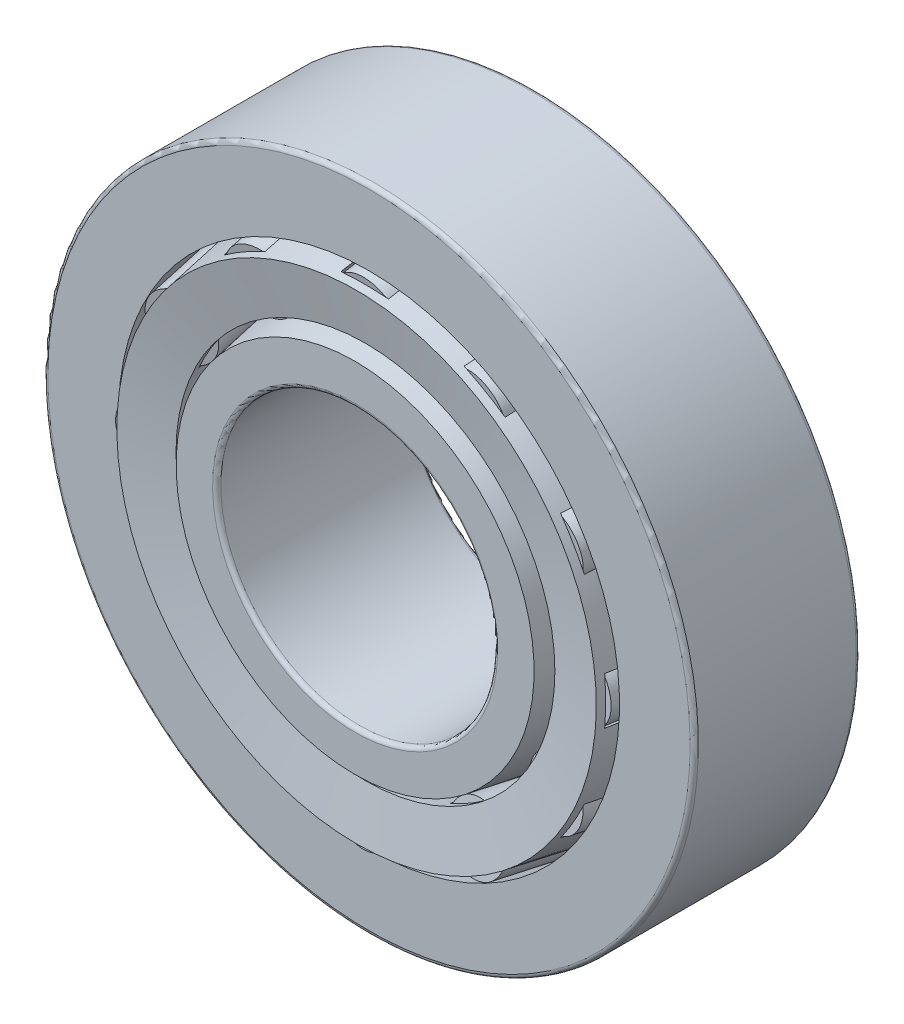
from build123d import *

# Parameters (mm, degrees)
CIRPATTERN1_COUNT = 12
CIRPATTERN2_COUNT = 12
CIRPATTERN2_ANGLE = 330
FILLET1_R         = 0.3
FILLET2_R         = 0.3


with BuildPart() as part:
    # Sketch1 → Revolve1 (revolve)
    with BuildSketch(Plane(origin=(0, 0, 0), x_dir=(0, 0, -1), z_dir=(1, 0, 0)), mode=Mode.PRIVATE) as revolve1_sk:
        Polygon((-6, 23.5), (6, 23.5), (6, 20.215923769), (-6, 18.1), align=None)
    revolve(revolve1_sk.sketch.rotate(Axis((0, 0, 7), (0, 0, -1)), 180), axis=Axis((0, 0, 7), (0, 0, -1)))

    # Fillet1
    fillet1_edges = [part.edges().sort_by_distance(p)[0] for p in [
        (0, 23.5, -6),
        (0, 23.5, 6),
    ]]
    fillet(fillet1_edges, radius=FILLET1_R)


with BuildPart() as body_2:
    # Sketch5 → Revolve4 (revolve)
    with BuildSketch(Plane(origin=(0, 0, 0), x_dir=(0, 0, -1), z_dir=(1, 0, 0)), mode=Mode.PRIVATE) as revolve4_sk:
        Polygon((7, 15.4), (-7, 12.93142227), (-7, 10), (7, 10), align=None)
    revolve(revolve4_sk.sketch.rotate(Axis((0, 0, 7), (0, 0, -1)), 180), axis=Axis((0, 0, 7), (0, 0, -1)))

    # Fillet2
    fillet2_edges = [body_2.edges().sort_by_distance(p)[0] for p in [
        (0, 10, 7),
        (0, 10, -7),
    ]]
    fillet(fillet2_edges, radius=FILLET2_R)


with BuildPart() as body_3:
    # Sketch2 → Revolve2 (revolve)
    with BuildSketch(Plane(origin=(0, 0, 0), x_dir=(0, 0, -1), z_dir=(1, 0, 0)), mode=Mode.PRIVATE) as revolve2_sk:
        Polygon((-6.893284355, 17.318458523), (-6.252990486, 13.687171546), (6, 15.847704363), (8.143284355, 16.225623222), (7.502990486, 19.856910199), (6, 19.591892425), align=None)
    revolve(revolve2_sk.sketch.rotate(Axis((0, 0, 7), (0, 0, -1)), 180), axis=Axis((0, 0, 7), (0, 0, -1)))

    # Sketch3 → Cut-Revolve1 (revolve, cut)
    with BuildSketch(Plane(origin=(0, 0, 0), x_dir=(0, 0, -1), z_dir=(1, 0, 0))):
        Polygon((-6, 15.603874625), (-6.426862579, 18.02473261), (5.573137421, 20.140656379), (6, 17.719798394), align=None)
    cut_revolve1 = revolve(axis=Axis((0, 15.502815034, 6.573137421), (0, 0.17364817766692742, -0.9848077530122086)), mode=Mode.SUBTRACT)

    # CirPattern1: Cut-Revolve1 ×12 about axis
    cirpattern1_axis = Axis((0, 0, 0), (0, 0, 1))
    for i in range(1, CIRPATTERN1_COUNT):
        add(cut_revolve1.rotate(cirpattern1_axis, i * 360 / CIRPATTERN1_COUNT), mode=Mode.SUBTRACT)


with BuildPart() as body_4:
    # Sketch4 → Revolve3 (revolve)
    with BuildSketch(Plane(origin=(0, 0, 0), x_dir=(0, 0, -1), z_dir=(1, 0, 0)), mode=Mode.PRIVATE) as revolve3_sk:
        Polygon((-6.404809261, 17.899662026), (5.595190739, 20.015585794), (6, 17.719798394), (-6, 15.603874625), align=None)
    revolve(revolve3_sk.sketch.rotate(Axis((0, 15.502815034, 6.573137421), (0, 0.17364817766692742, -0.9848077530122086)), 180), axis=Axis((0, 15.502815034, 6.573137421), (0, 0.17364817766692742, -0.9848077530122086)))


with BuildPart() as cirpattern2_1:
    # CirPattern2: pattern copy
    add(body_4.part.rotate(Axis((0, 0, -7), (0, 0, 1)), 1 * CIRPATTERN2_ANGLE / (CIRPATTERN2_COUNT - 1)))


with BuildPart() as cirpattern2_2:
    # CirPattern2: pattern copy
    add(body_4.part.rotate(Axis((0, 0, -7), (0, 0, 1)), 2 * CIRPATTERN2_ANGLE / (CIRPATTERN2_COUNT - 1)))


with BuildPart() as cirpattern2_3:
    # CirPattern2: pattern copy
    add(body_4.part.rotate(Axis((0, 0, -7), (0, 0, 1)), 3 * CIRPATTERN2_ANGLE / (CIRPATTERN2_COUNT - 1)))


with BuildPart() as cirpattern2_4:
    # CirPattern2: pattern copy
    add(body_4.part.rotate(Axis((0, 0, -7), (0, 0, 1)), 4 * CIRPATTERN2_ANGLE / (CIRPATTERN2_COUNT - 1)))


with BuildPart() as cirpattern2_5:
    # CirPattern2: pattern copy
    add(body_4.part.rotate(Axis((0, 0, -7), (0, 0, 1)), 5 * CIRPATTERN2_ANGLE / (CIRPATTERN2_COUNT - 1)))


with BuildPart() as cirpattern2_6:
    # CirPattern2: pattern copy
    add(body_4.part.rotate(Axis((0, 0, -7), (0, 0, 1)), 6 * CIRPATTERN2_ANGLE / (CIRPATTERN2_COUNT - 1)))


with BuildPart() as cirpattern2_7:
    # CirPattern2: pattern copy
    add(body_4.part.rotate(Axis((0, 0, -7), (0, 0, 1)), 7 * CIRPATTERN2_ANGLE / (CIRPATTERN2_COUNT - 1)))


with BuildPart() as cirpattern2_8:
    # CirPattern2: pattern copy
    add(body_4.part.rotate(Axis((0, 0, -7), (0, 0, 1)), 8 * CIRPATTERN2_ANGLE / (CIRPATTERN2_COUNT - 1)))


with BuildPart() as cirpattern2_9:
    # CirPattern2: pattern copy
    add(body_4.part.rotate(Axis((0, 0, -7), (0, 0, 1)), 9 * CIRPATTERN2_ANGLE / (CIRPATTERN2_COUNT - 1)))


with BuildPart() as cirpattern2_10:
    # CirPattern2: pattern copy
    add(body_4.part.rotate(Axis((0, 0, -7), (0, 0, 1)), 10 * CIRPATTERN2_ANGLE / (CIRPATTERN2_COUNT - 1)))


with BuildPart() as cirpattern2_11:
    # CirPattern2: pattern copy
    add(body_4.part.rotate(Axis((0, 0, -7), (0, 0, 1)), 11 * CIRPATTERN2_ANGLE / (CIRPATTERN2_COUNT - 1)))


solid = Compound([part.part, body_2.part, body_3.part, body_4.part, cirpattern2_1.part, cirpattern2_2.part, cirpattern2_3.part, cirpattern2_4.part, cirpattern2_5.part, cirpattern2_6.part, cirpattern2_7.part, cirpattern2_8.part, cirpattern2_9.part, cirpattern2_10.part, cirpattern2_11.part])
